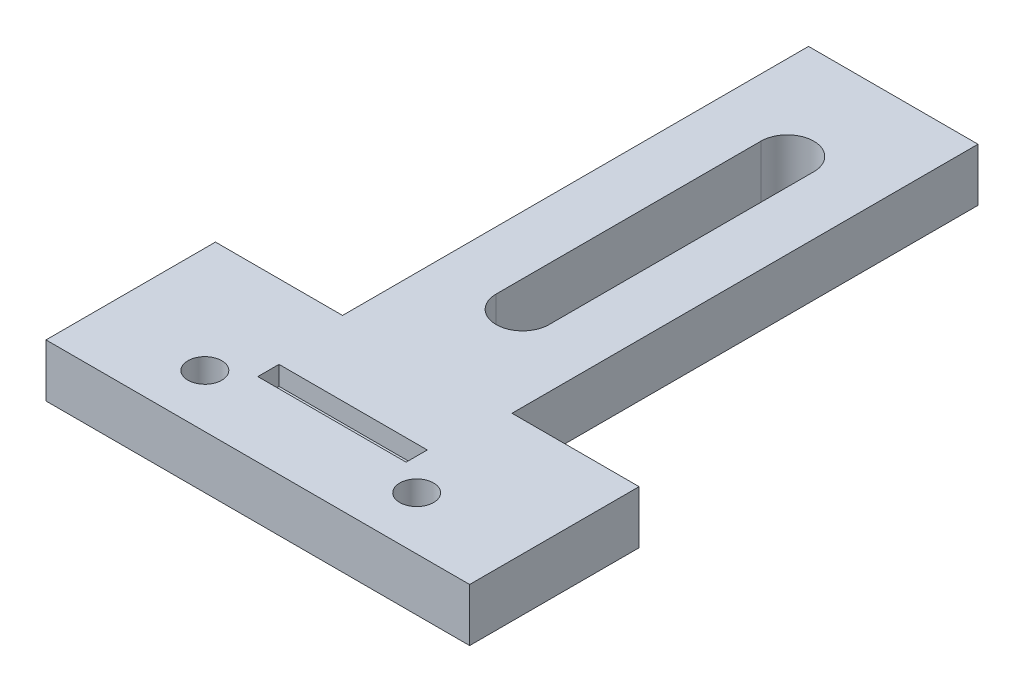
from build123d import *

# Parameters (mm, degrees)
SKETCH_2_R          = 1.6
EXTRUDE_2_DEPTH     = 5
CUT_EXTRUDE_1_DEPTH = 56.009090158
SKETCH_6_W          = 14
SKETCH_6_H          = 2
CUT_EXTRUDE_2_DEPTH = 1.8


with BuildPart() as part:
    # 草图2 → 凸台-拉伸2 (new body)
    with BuildSketch(Plane(origin=(0, 0, 0), x_dir=(1, 0, 0), z_dir=(0, 1, 0))):
        Polygon((-20, 16), (-8, 16), (-8, 60), (8, 60), (8, 16), (20, 16), (20, 0), (-20, 0), align=None)
        with Locations(Location((-10, 5, 0), (0, 0, 270))):
            Circle(SKETCH_2_R, mode=Mode.SUBTRACT)
        with Locations(Location((10, 5, 0), (0, 0, 270))):
            Circle(SKETCH_2_R, mode=Mode.SUBTRACT)
    extrude(amount=-EXTRUDE_2_DEPTH)

    # 草图5 → 切除-拉伸1 (cut, through all)
    with BuildSketch(Plane(origin=(0, -5, -9), x_dir=(1, 0, 0), z_dir=(0, 1, 0))):
        with BuildLine():
            Line((2.5, 41), (2.5, 16))
            ThreePointArc((2.5, 16), (0, 13.5), (-2.5, 16))
            Line((-2.5, 16), (-2.5, 41))
            ThreePointArc((-2.5, 41), (0, 43.5), (2.5, 41))
        make_face()
    extrude(amount=CUT_EXTRUDE_1_DEPTH, mode=Mode.SUBTRACT)

    # 草图6 → 切除-拉伸2 (cut)
    with BuildSketch(Plane(origin=(0, 0, 0), x_dir=(1, 0, 0), z_dir=(0, 1, 0))):
        with Locations((0, 8)):
            Rectangle(SKETCH_6_W, SKETCH_6_H)
    extrude(amount=-CUT_EXTRUDE_2_DEPTH, mode=Mode.SUBTRACT)


solid = part.part
